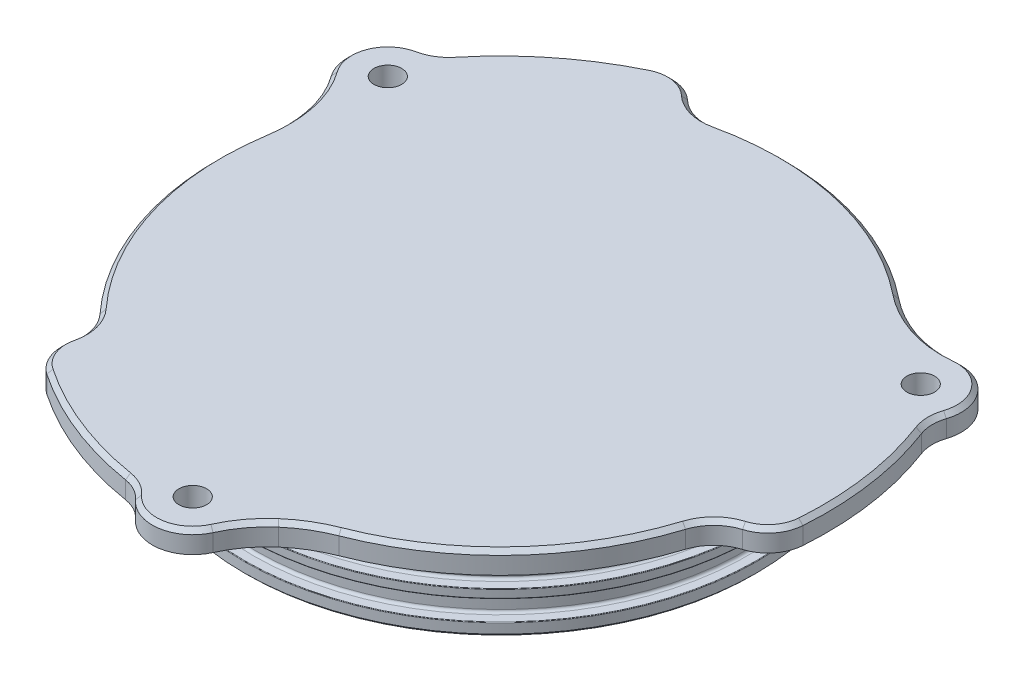
from build123d import *

# Parameters (mm, degrees)
BOSS_EXTRUDE1_START     = -5.08
BOSS_EXTRUDE1_DEPTH     = 5.08
F_1_4_CLEARANCE_HOLE1_D = 6.5278
CIRPATTERN1_COUNT       = 3
CHAMFER1_SIZE           = 0.635
CHAMFER2_SIZE           = 1.016


with BuildPart() as part:
    # Sketch2 → Revolve1 (revolve)
    with BuildSketch(Plane.XY, mode=Mode.PRIVATE) as revolve1_sk:
        with BuildLine():
            Line((0, 0), (-66.675, 0))
            Line((-66.675, 0), (-66.675, -5.08))
            Line((-66.675, -5.08), (-60.9219, -5.08))
            ThreePointArc((-60.9219, -5.08), (-60.472887194, -5.265987194), (-60.2869, -5.715))
            Line((-60.2869, -5.715), (-60.2869, -7.493))
            ThreePointArc((-60.2869, -7.493), (-60.249702561, -7.582802561), (-60.1599, -7.62))
            Line((-60.1599, -7.62), (-58.1406, -7.62))
            ThreePointArc((-58.1406, -7.62), (-57.691587194, -7.805987194), (-57.5056, -8.255))
            Line((-57.5056, -8.255), (-57.5056, -11.7348))
            ThreePointArc((-57.5056, -11.7348), (-57.691587194, -12.183812806), (-58.1406, -12.3698))
            Line((-58.1406, -12.3698), (-60.1599, -12.3698))
            ThreePointArc((-60.1599, -12.3698), (-60.249702561, -12.406997439), (-60.2869, -12.4968))
            Line((-60.2869, -12.4968), (-60.2869, -14.2748))
            ThreePointArc((-60.2869, -14.2748), (-60.249702561, -14.364602561), (-60.1599, -14.4018))
            Line((-60.1599, -14.4018), (-58.1406, -14.4018))
            ThreePointArc((-58.1406, -14.4018), (-57.691587194, -14.587787194), (-57.5056, -15.0368))
            Line((-57.5056, -15.0368), (-57.5056, -18.5166))
            ThreePointArc((-57.5056, -18.5166), (-57.691587194, -18.965612806), (-58.1406, -19.1516))
            Line((-58.1406, -19.1516), (-60.1599, -19.1516))
            ThreePointArc((-60.1599, -19.1516), (-60.249702561, -19.188797439), (-60.2869, -19.2786))
            Line((-60.2869, -19.2786), (-60.2869, -22.225))
            Line((-60.2869, -22.225), (-52.07, -22.225))
            Line((-52.07, -22.225), (-52.07, -5.08))
            Line((-52.07, -5.08), (0, -5.08))
            Line((0, -5.08), (0, 0))
        make_face()
    revolve(revolve1_sk.sketch.rotate(Axis((0, 0, 0), (0, 1, 0)), 270), axis=Axis((0, 0, 0), (0, 1, 0)))

    # Sketch11 → Boss-Extrude1 (add)
    with BuildSketch(Plane(origin=(0, 0, 0), x_dir=(1, 0, 0), z_dir=(0, 1, 0)).offset(BOSS_EXTRUDE1_START)):
        with BuildLine():
            ThreePointArc((-33.552594205, 69.12192595), (-47.644606361, 60.279421943), (-59.502933581, 48.610884791))
            ThreePointArc((-59.502933581, 48.610884791), (-61.786881136, 46.628330159), (-64.603298745, 45.526181733))
            ThreePointArc((-64.603298745, 45.526181733), (-71.564434866, 39.658820639), (-70.41968082, 30.627050022))
            ThreePointArc((-70.41968082, 30.627050022), (-67.700076965, 25.827577718), (-66.080812198, 20.554138506))
            ThreePointArc((-66.080812198, 20.554138506), (-65.542300069, 15.371802621), (-65.894280688, 10.17346537))
            ThreePointArc((-65.894280688, 10.17346537), (-48.65367551, 45.589203595), (-14.432783616, 65.0941655))
            ThreePointArc((-14.432783616, 65.0941655), (-19.320660202, 65.215467726), (-23.585884096, 67.605847797))
            ThreePointArc((-23.585884096, 67.605847797), (-28.333559435, 69.913247243), (-33.552594205, 69.12192595))
        make_face()
    boss_extrude1 = extrude(amount=BOSS_EXTRUDE1_DEPTH)

    # 1/4 Clearance Hole1 (through all)
    with Locations(Plane(origin=(-10.459851596, 0, 18.14366046), x_dir=(-1, 0, 0), z_dir=(0, 1, 0))):
        with Locations((52.231727384, -54.33866046)):
            f_1_4_clearance_hole1 = Hole(F_1_4_CLEARANCE_HOLE1_D / 2)

    # CirPattern1: Boss-Extrude1, 1/4 Clearance Hole1 ×3 about axis
    cirpattern1_axis = Axis((0, 0, 0), (0, 1, 0))
    add([boss_extrude1.rotate(cirpattern1_axis, i * 360 / CIRPATTERN1_COUNT) for i in range(1, CIRPATTERN1_COUNT)])
    add([f_1_4_clearance_hole1.rotate(cirpattern1_axis, i * 360 / CIRPATTERN1_COUNT) for i in range(1, CIRPATTERN1_COUNT)], mode=Mode.SUBTRACT)

    # Chamfer1
    chamfer1_edges = [part.edges().sort_by_distance(p)[0] for p in [
        (0, -22.225, 60.2869),
    ]]
    chamfer(chamfer1_edges, length=CHAMFER1_SIZE)

    # Chamfer2
    chamfer2_edges = [part.edges().sort_by_distance(p)[0] for p in [
        (15.154570696, 0, -64.929920776),
        (-19.320660202, 0, -65.215467726),
        (-28.333559435, 0, -69.913247243),
        (-47.644606361, 0, -60.279421943),
        (-61.786881136, 0, -46.628330159),
        (-71.564434866, 0, -39.658820639),
        (-67.700076965, 0, -25.827577718),
        (-65.542300069, 0, -15.371802621),
        (48.65367551, 0, 45.589203595),
        (66.138581871, 0, 15.87555131),
        (74.713427891, 0, 10.419041371),
        (76.025813908, 0, -11.12172849),
        (71.274759022, 0, -30.194843605),
        (70.127763591, 0, -42.147208282),
        (56.217376905, 0, -45.716197631),
        (46.083521606, 0, -49.075395572),
        (-63.808246206, 0, 19.340717182),
        (-46.817921669, 0, 49.339916416),
        (-46.379868456, 0, 59.494205872),
        (-28.381207547, 0, 71.401150433),
        (-9.487877886, 0, 76.823173764),
        (1.436671275, 0, 81.806028921),
        (11.48270006, 0, 71.543775349),
        (19.458778463, 0, 64.447198193),
    ]]
    chamfer(chamfer2_edges, length=CHAMFER2_SIZE)


solid = part.part
